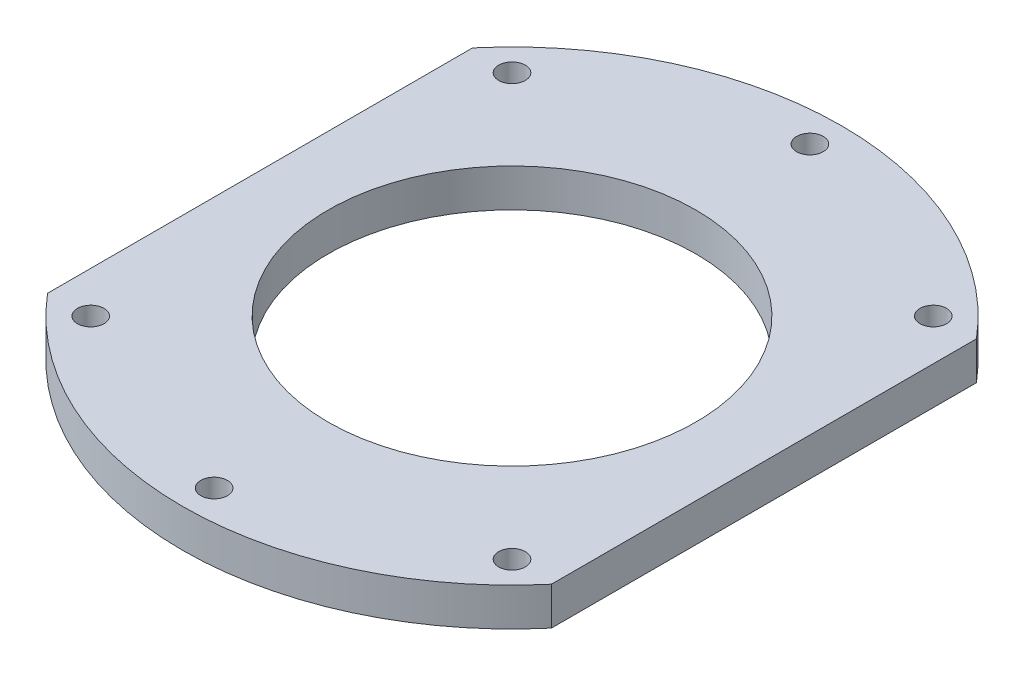
from build123d import *

# Parameters (mm, degrees)
SKETCH_1_R          = 52
SKETCH_1_R_2        = 29
SKETCH_1_R_3        = 2.1
EXTRUDE_1_DEPTH     = 6
SKETCH_2_W          = 179.5
SKETCH_2_H          = 210.035227354
SKETCH_2_W_2        = 79.5
SKETCH_2_H_2        = 110.035227354
CUT_EXTRUDE_1_DEPTH = 10


with BuildPart() as part:
    # 草图1 → 凸台-拉伸1 (new body)
    with BuildSketch(Plane(origin=(0, 0, 0), x_dir=(1, 0, 0), z_dir=(0, 1, 0))):
        with Locations(Location((0, 0, 0), (0, 0, 270))):
            Circle(SKETCH_1_R)
        with Locations(Location((0, 0, 0), (0, 0, 270))):
            Circle(SKETCH_1_R_2, mode=Mode.SUBTRACT)
        with Locations(Location((47, 0, 0), (0, 0, 270))):
            Circle(SKETCH_1_R_3, mode=Mode.SUBTRACT)
        with Locations(Location((33.234018716, -33.234018716, 0), (0, 0, 270))):
            Circle(SKETCH_1_R_3, mode=Mode.SUBTRACT)
        with Locations(Location((0, -47, 0), (0, 0, 270))):
            Circle(SKETCH_1_R_3, mode=Mode.SUBTRACT)
        with Locations(Location((-33.234018716, -33.234018716, 0), (0, 0, 270))):
            Circle(SKETCH_1_R_3, mode=Mode.SUBTRACT)
        with Locations(Location((-47, 0, 0), (0, 0, 270))):
            Circle(SKETCH_1_R_3, mode=Mode.SUBTRACT)
        with Locations(Location((-33.234018716, 33.234018716, 0), (0, 0, 270))):
            Circle(SKETCH_1_R_3, mode=Mode.SUBTRACT)
        with Locations(Location((0, 47, 0), (0, 0, 270))):
            Circle(SKETCH_1_R_3, mode=Mode.SUBTRACT)
        with Locations(Location((33.234018716, 33.234018716, 0), (0, 0, 270))):
            Circle(SKETCH_1_R_3, mode=Mode.SUBTRACT)
    extrude(amount=EXTRUDE_1_DEPTH)

    # 草图2 → 切除-拉伸-薄壁1 (cut)
    with BuildSketch(Plane(origin=(0, 6, 0), x_dir=(1, 0, 0), z_dir=(0, 1, 0))):
        Rectangle(SKETCH_2_W, SKETCH_2_H)
        Rectangle(SKETCH_2_W_2, SKETCH_2_H_2, mode=Mode.SUBTRACT)
    extrude(amount=-CUT_EXTRUDE_1_DEPTH, mode=Mode.SUBTRACT)


solid = part.part
